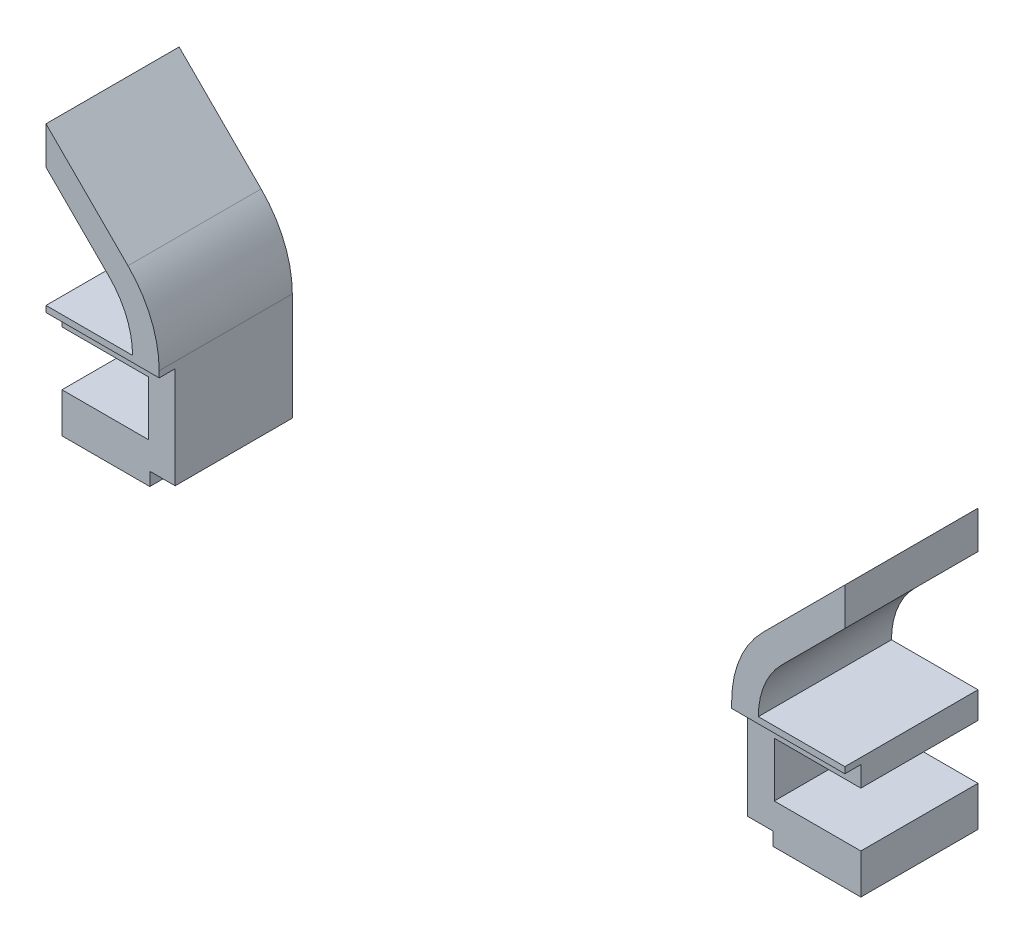
from build123d import *

# Parameters (mm, degrees)
BOSS_EXTRUDE1_DEPTH = 100
SKETCH2_W           = 12
SKETCH2_H           = 76.2
CUT_EXTRUDE1_DEPTH  = 182.245689604
SKETCH3_W           = 65.95
SKETCH3_H           = 88
BOSS_EXTRUDE2_DEPTH = 10


with BuildPart() as part:
    # Sketch1 → Boss-Extrude1 (new body)
    with BuildSketch(Plane.XY):
        with BuildLine():
            Line((300, 74), (238.431457505, 12.431457505))
            ThreePointArc((238.431457505, 12.431457505), (221.089637399, -13.522410401), (215, -44.13708499))
            Line((215, -44.13708499), (215, -105))
            Line((215, -105), (215, -125))
            Line((215, -125), (234.05, -125))
            Line((234.05, -125), (300, -125))
            Line((300, -125), (300, -105))
            Line((300, -105), (235, -105))
            Line((235, -105), (235, -64.13708499))
            Line((235, -64.13708499), (300, -64.13708499))
            Line((300, -64.13708499), (300, -44.13708499))
            Line((300, -44.13708499), (235, -44.13708499))
            ThreePointArc((235, -44.13708499), (239.567228049, -21.176079048), (252.573593129, -1.710678119))
            Line((252.573593129, -1.710678119), (300, 45.715728753))
            Line((300, 45.715728753), (300, 74))
        make_face()
    extrude(amount=BOSS_EXTRUDE1_DEPTH)

    # Sketch2 → Cut-Extrude1 (cut, through all)
    with BuildSketch(Plane.ZY.offset(-215)):
        with Locations((94, -86.9)):
            Rectangle(SKETCH2_W, SKETCH2_H)
    extrude(amount=-CUT_EXTRUDE1_DEPTH, mode=Mode.SUBTRACT)

    # Sketch3 → Boss-Extrude2 (add)
    with BuildSketch(Plane.XZ.offset(125)):
        with Locations((267.025, 44)):
            Rectangle(SKETCH3_W, SKETCH3_H)
    extrude(amount=BOSS_EXTRUDE2_DEPTH)


with BuildPart() as body_2:
    # Mirror1: mirrored copy
    add(part.part.mirror(Plane(origin=(0, 0, 0), x_dir=(0, 0, 1), z_dir=(1, 0, 0))))


solid = Compound([part.part, body_2.part])
